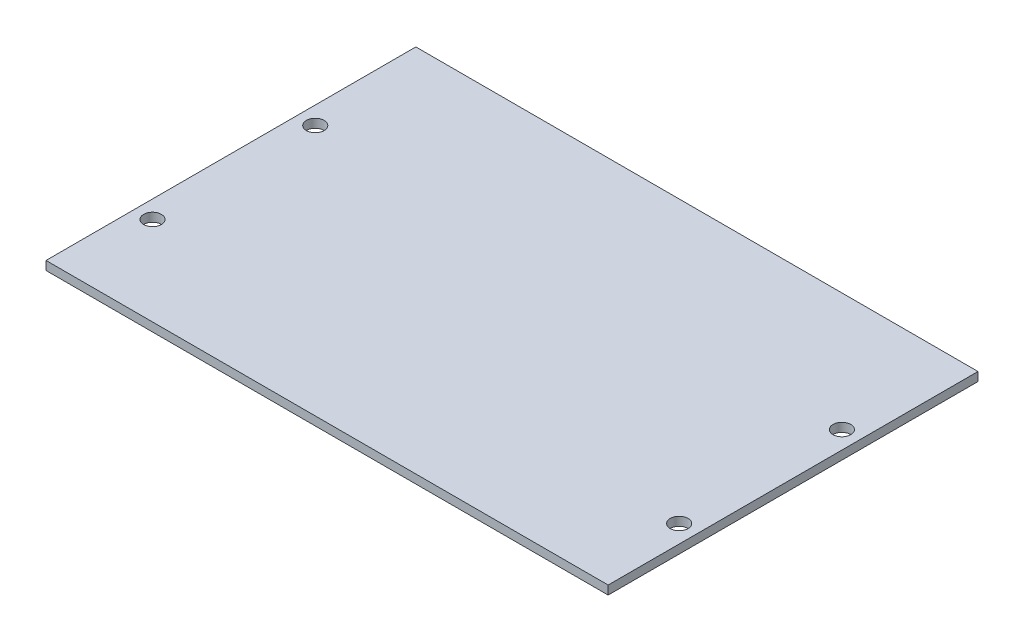
from build123d import *

# Parameters (mm, degrees)
SKETCH1_W           = 96.52
SKETCH1_H           = 63.5
BOSS_EXTRUDE1_DEPTH = 1.4986
SKETCH2_R           = 1.524
MOUTING_HOLES_DEPTH = 1.4986


with BuildPart() as part:
    # Sketch1 → Boss-Extrude1 (new body)
    with BuildSketch(Plane(origin=(0, 0, 0), x_dir=(1, 0, 0), z_dir=(0, 1, 0))):
        with Locations((-17.75984127, 3.275793651)):
            Rectangle(SKETCH1_W, SKETCH1_H)
    extrude(amount=BOSS_EXTRUDE1_DEPTH)

    # Sketch2 → mouting holes (cut)
    with BuildSketch(Plane(origin=(0, 1.4986, 0), x_dir=(1, 0, 0), z_dir=(0, 1, 0))):
        with Locations(Location((-62.97184127, 14.705793651, 0), (0, 0, 270))):
            Circle(SKETCH2_R)
        with Locations(Location((-62.97184127, -13.234206349, 0), (0, 0, 270))):
            Circle(SKETCH2_R)
        with Locations(Location((27.45215873, 14.705793651, 0), (0, 0, 270))):
            Circle(SKETCH2_R)
        with Locations(Location((27.45215873, -13.234206349, 0), (0, 0, 270))):
            Circle(SKETCH2_R)
    extrude(amount=-MOUTING_HOLES_DEPTH, mode=Mode.SUBTRACT)


solid = part.part
